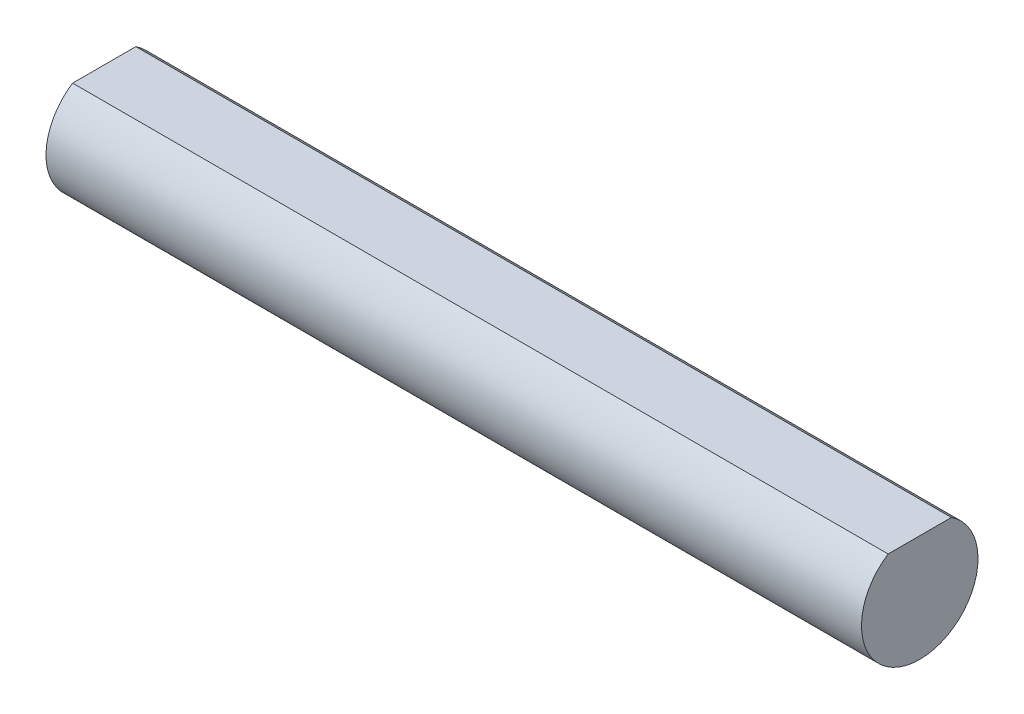
from build123d import *

# Parameters (mm, degrees)
BOSS_EXTRUDE1_DEPTH = 35


with BuildPart() as part:
    # Sketch1 → Boss-Extrude1 (new body)
    with BuildSketch(Plane(origin=(0, 0, 0), x_dir=(0, 0, -1), z_dir=(1, 0, 0))):
        with BuildLine():
            Line((1.356465997, 2.1), (-1.356465997, 2.1))
            ThreePointArc((-1.356465997, 2.1), (0, -2.5), (1.356465997, 2.1))
        make_face()
    extrude(amount=BOSS_EXTRUDE1_DEPTH)


solid = part.part
